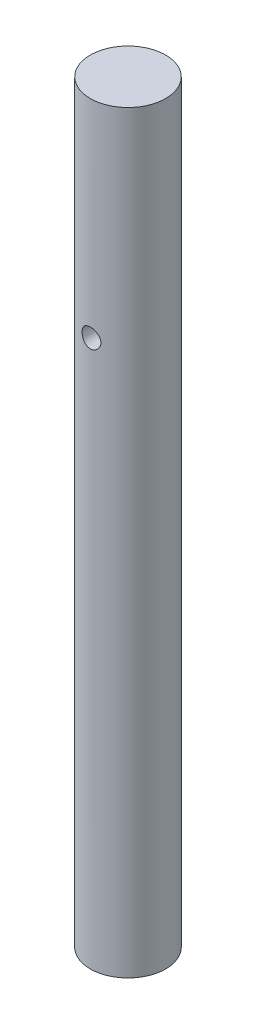
from build123d import *

# Parameters (mm, degrees)
SKETCH1_R           = 40
BOSS_EXTRUDE1_DEPTH = 800
SKETCH2_R           = 10
CUT_EXTRUDE1_DEPTH  = 400


with BuildPart() as part:
    # Sketch1 → Boss-Extrude1 (new body)
    with BuildSketch(Plane(origin=(0, 0, 0), x_dir=(1, 0, 0), z_dir=(0, 1, 0))):
        with Locations(Location((0, 0, 0), (0, 0, 270))):
            Circle(SKETCH1_R)
    extrude(amount=BOSS_EXTRUDE1_DEPTH)

    # Sketch2 → Cut-Extrude1 (cut, symmetric)
    with BuildSketch(Plane.XY):
        with Locations(Location((0, 580, 0), (0, 0, 90))):
            Circle(SKETCH2_R)
    extrude(amount=CUT_EXTRUDE1_DEPTH, both=True, mode=Mode.SUBTRACT)


solid = part.part
